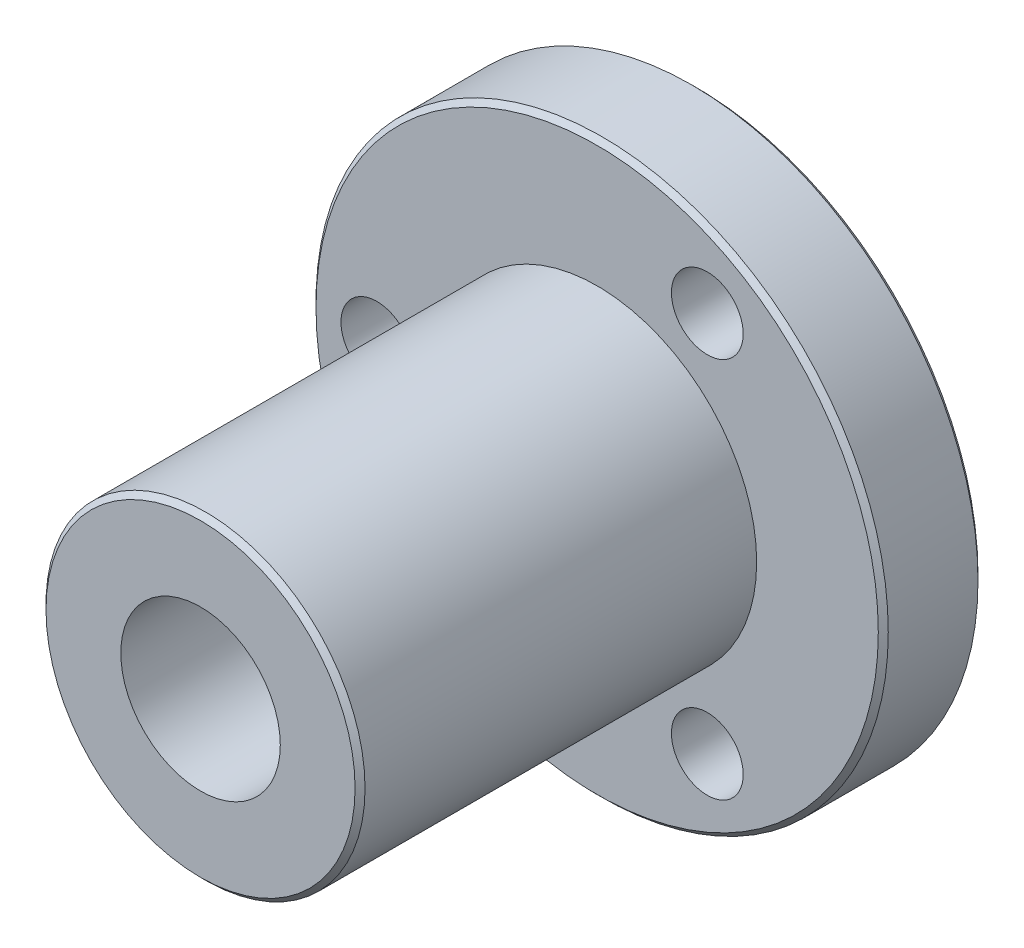
from build123d import *

# Parameters (mm, degrees)
SKETCH1_W                  = 14.351
SKETCH1_H                  = 5
SKETCH2_R                  = 8.001
BOSS_EXTRUDE1_DEPTH        = 19.892
F_3_6_3_6_DIAMETER_HOLE1_D = 3.6
F_8_0_8_DIAMETER_HOLE1_D   = 8
CHAMFER1_SIZE              = 0.25


with BuildPart() as part:
    # Sketch1 → Revolve1 (revolve)
    with BuildSketch(Plane(origin=(0, 0, 0), x_dir=(1, 0, 0), z_dir=(0, 1, 0))):
        with Locations((7.1755, -2.5)):
            Rectangle(SKETCH1_W, SKETCH1_H)
    revolve(axis=Axis((0, 0, 0), (0, 0, 1)))

    # Sketch2 → Boss-Extrude1 (add)
    with BuildSketch(Plane.XY.offset(5)):
        Circle(SKETCH2_R)
    extrude(amount=BOSS_EXTRUDE1_DEPTH)

    # Ø3.6 (3.6) Diameter Hole1 (through all)
    with Locations(Plane.XY.offset(5)):
        with Locations((5.5245, -9.568714686), (-11.049, 0), (5.5245, 9.568714686)):
            Hole(F_3_6_3_6_DIAMETER_HOLE1_D / 2)

    # Ø8.0 (8) Diameter Hole1 (through all)
    with Locations(Plane.XY.offset(24.892)):
        with Locations((0, 0)):
            Hole(F_8_0_8_DIAMETER_HOLE1_D / 2)

    # Chamfer1
    chamfer1_edges = [part.edges().sort_by_distance(p)[0] for p in [
        (-14.351, 0, 5),
        (-14.351, 0, 0),
        (-8.001, 0, 24.892),
    ]]
    chamfer(chamfer1_edges, length=CHAMFER1_SIZE)


solid = part.part
